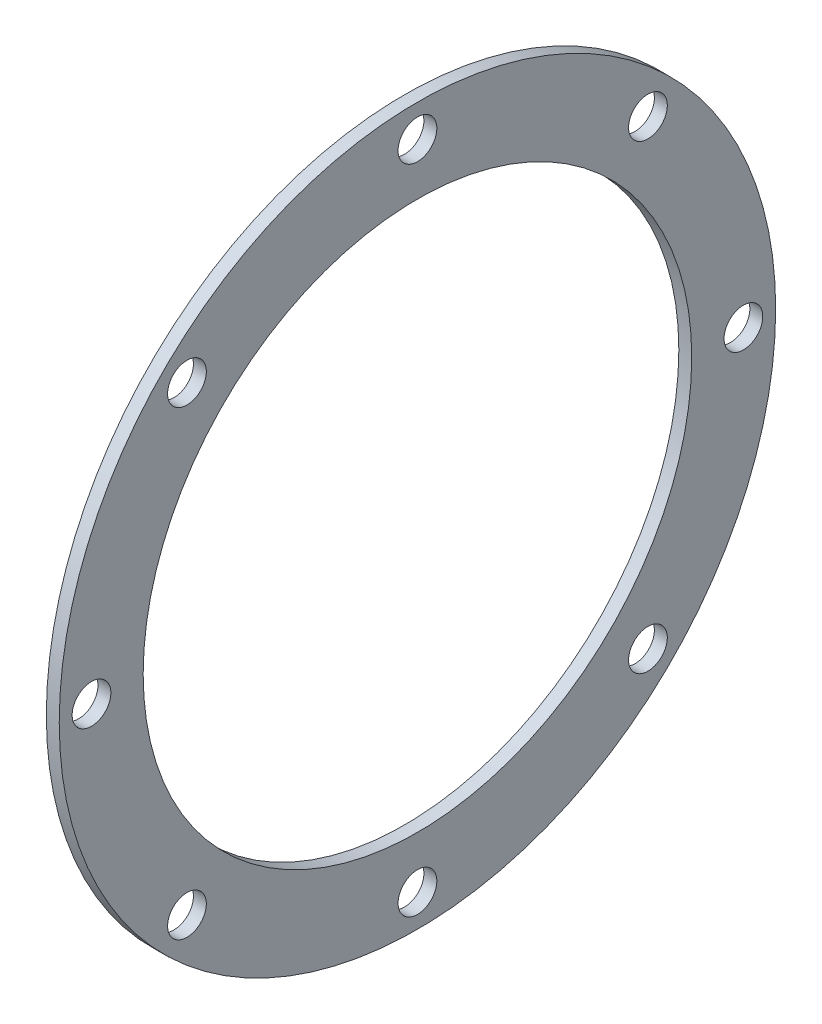
from build123d import *

# Parameters (mm, degrees)
SKETCH1_R           = 55.5
SKETCH1_R_2         = 42.495
BOSS_EXTRUDE1_DEPTH = 2
SKETCH2_R           = 3
CUT_EXTRUDE1_DEPTH  = 15


with BuildPart() as part:
    # Sketch1 → Boss-Extrude1 (new body)
    with BuildSketch(Plane(origin=(0, 0, 0), x_dir=(0, 0, -1), z_dir=(1, 0, 0))):
        Circle(SKETCH1_R)
        Circle(SKETCH1_R_2, mode=Mode.SUBTRACT)
    extrude(amount=BOSS_EXTRUDE1_DEPTH)

    # Sketch2 → Cut-Extrude1 (cut)
    with BuildSketch(Plane.ZY):
        with Locations((0, 50.5)):
            Circle(SKETCH2_R)
        with Locations((35.70889245, 35.70889245)):
            Circle(SKETCH2_R)
        with Locations((50.5, 0)):
            Circle(SKETCH2_R)
        with Locations((35.70889245, -35.70889245)):
            Circle(SKETCH2_R)
        with Locations((0, -50.5)):
            Circle(SKETCH2_R)
        with Locations((-35.70889245, -35.70889245)):
            Circle(SKETCH2_R)
        with Locations((-50.5, 0)):
            Circle(SKETCH2_R)
        with Locations((-35.70889245, 35.70889245)):
            Circle(SKETCH2_R)
    extrude(amount=-CUT_EXTRUDE1_DEPTH, mode=Mode.SUBTRACT)


solid = part.part
